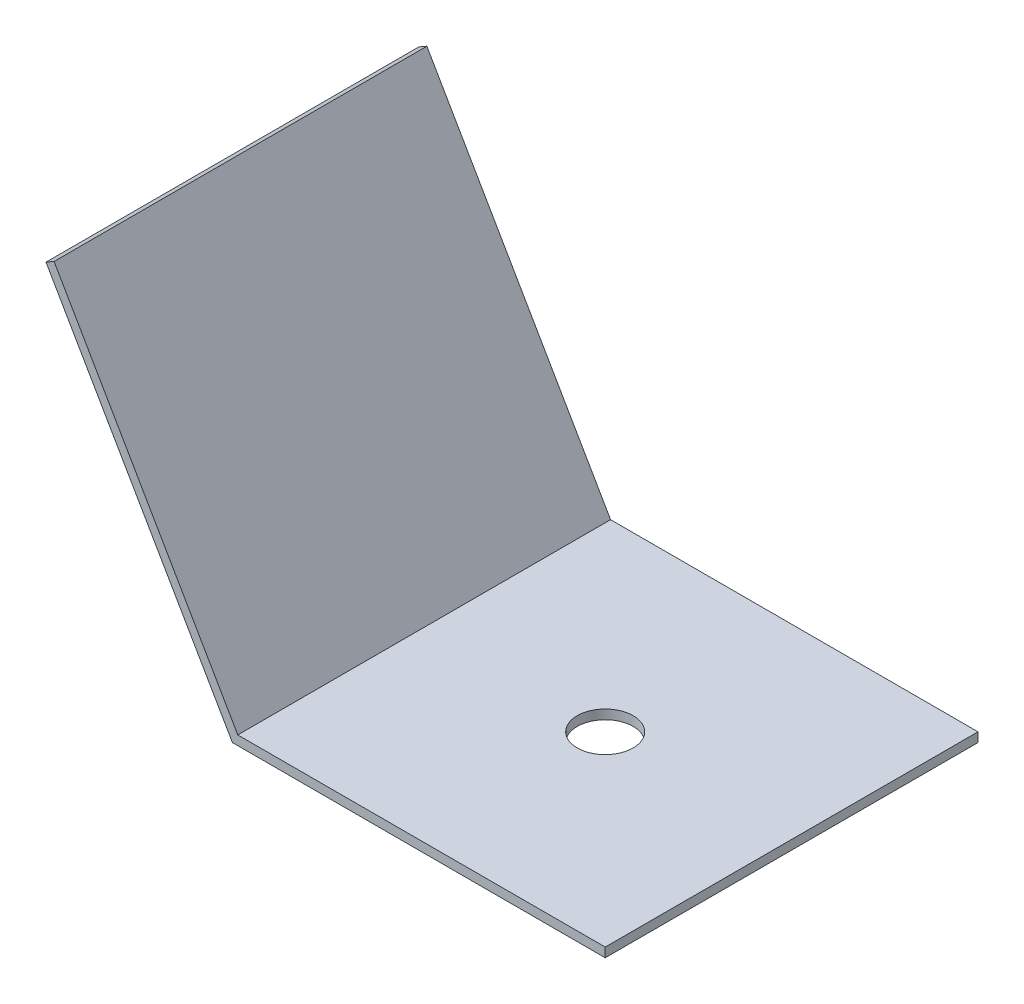
from build123d import *

# Parameters (mm, degrees)
SKETCH_1_W      = 40
SKETCH_1_H      = 40
SKETCH_1_R      = 3
EXTRUDE_3_DEPTH = 1
SKETCH_3_W      = 40
SKETCH_3_H      = 40
EXTRUDE_5_DEPTH = 1


with BuildPart() as part:
    # 草图1 → 凸台-拉伸3 (new body)
    with BuildSketch(Plane(origin=(0, 0, 0), x_dir=(1, 0, 0), z_dir=(0, 1, 0))):
        Rectangle(SKETCH_1_W, SKETCH_1_H)
        with Locations(Location((0, 0, 0), (0, 0, 270))):
            Circle(SKETCH_1_R, mode=Mode.SUBTRACT)
    extrude(amount=EXTRUDE_3_DEPTH)

    # 草图3 → 凸台-拉伸5 (add)
    with BuildSketch(Plane(origin=(-15, -8.660254038, 0), x_dir=(0, 0, 1), z_dir=(0.8660254037844346, 0.5000000000000071, 0))):
        with Locations((0, -30)):
            Rectangle(SKETCH_3_W, SKETCH_3_H)
    extrude(amount=EXTRUDE_5_DEPTH)


solid = part.part
